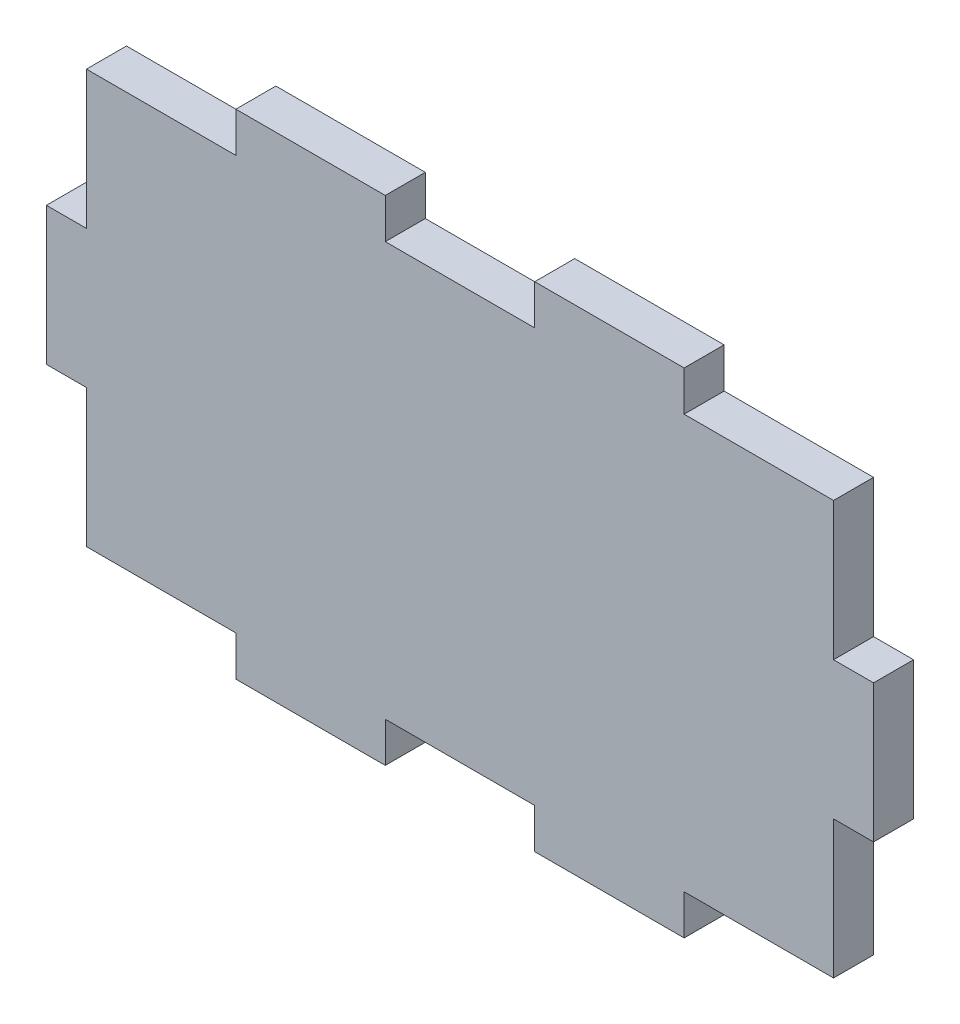
from build123d import *

# Parameters (mm, degrees)
BOSS_EXTRU_3_DEPTH = 3


with BuildPart() as part:
    # Esquisse3 → Boss.-Extru.3 (new body)
    with BuildSketch(Plane.XY):
        Polygon((22.4, 0), (33.6, 0), (33.6, -3), (44.8, -3), (44.8, 0), (56, 0), (56, 10.33), (59, 10.33), (59, 20.66), (56, 20.66), (56, 31), (44.8, 31), (44.8, 34), (33.6, 34), (33.6, 31), (22.4, 31), (22.4, 34), (11.2, 34), (11.2, 31), (0, 31), (0, 20.66), (-3, 20.66), (-3, 10.33), (0, 10.33), (0, 0), (11.2, 0), (11.2, -3), (22.4, -3), align=None)
    extrude(amount=BOSS_EXTRU_3_DEPTH)


solid = part.part
